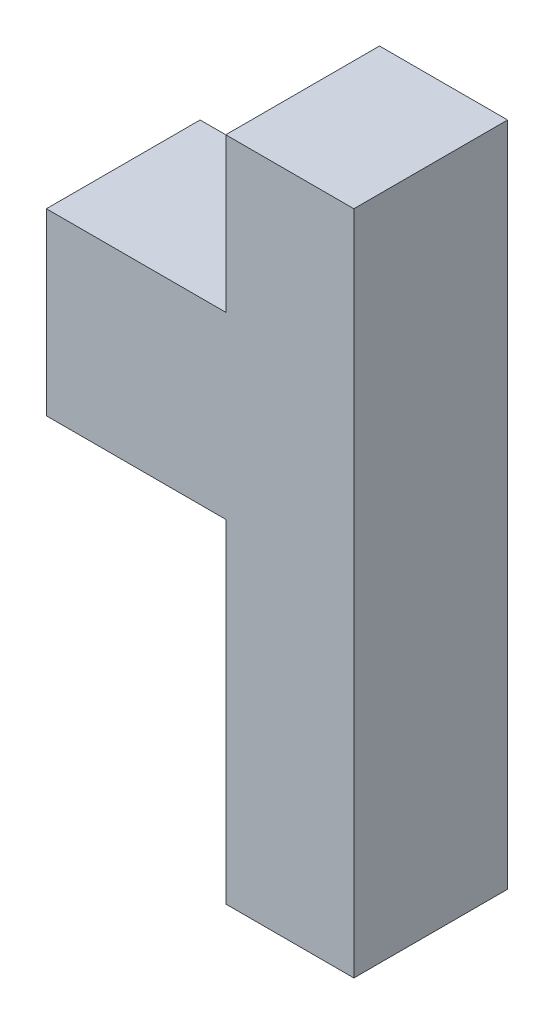
from build123d import *

# Parameters (mm, degrees)
BOSS_EXTRUDE1_DEPTH     = 30
CUT_EXTRUDE1_START      = -70
SKETCH2_W               = 25
SKETCH2_H               = 30
SKETCH2_W_2             = 5
SKETCH2_H_2             = 10
CUT_EXTRUDE1_DEPTH      = 10
CUT_EXTRUDE2_DEPTH      = 10
CUT_EXTRUDE2_DEPTH_BACK = 10
SKETCH3_R               = 2.5
FILLET1_R               = 1


with BuildPart() as part:
    # Sketch1 → Boss-Extrude1 (new body)
    with BuildSketch(Plane.XY):
        Polygon((-12.5, 70), (12.5, 70), (12.5, -70), (-12.5, -70), (-12.5, 5), (-47.5, 5), (-47.5, 40), (-12.5, 40), align=None)
    extrude(amount=BOSS_EXTRUDE1_DEPTH)

    # Sketch2 → Cut-Extrude1 (cut)
    with BuildSketch(Plane(origin=(0, 0, 0), x_dir=(1, 0, 0), z_dir=(0, 1, 0)).offset(CUT_EXTRUDE1_START)):
        with Locations((0, -15)):
            Rectangle(SKETCH2_W, SKETCH2_H)
        with Locations((0, -15)):
            Rectangle(SKETCH2_W_2, SKETCH2_H_2, mode=Mode.SUBTRACT)
    extrude(amount=CUT_EXTRUDE1_DEPTH, mode=Mode.SUBTRACT)

    # Sketch3 → Cut-Extrude2 (cut, two sides: drawn at the far end of the back side and taken through both)
    with BuildSketch(Plane(origin=(0, 0, 0), x_dir=(0, 0, -1), z_dir=(1, 0, 0)).offset(-CUT_EXTRUDE2_DEPTH_BACK)):
        with Locations(Location((-15, -65, 0), (0, 0, 180))):
            Circle(SKETCH3_R)
    extrude(amount=CUT_EXTRUDE2_DEPTH + CUT_EXTRUDE2_DEPTH_BACK, mode=Mode.SUBTRACT)

    # Fillet1
    fillet1_edges = [part.edges().sort_by_distance(p)[0] for p in [
        (0, -70, 10),
        (0, -70, 20),
    ]]
    fillet(fillet1_edges, radius=FILLET1_R)


solid = part.part
